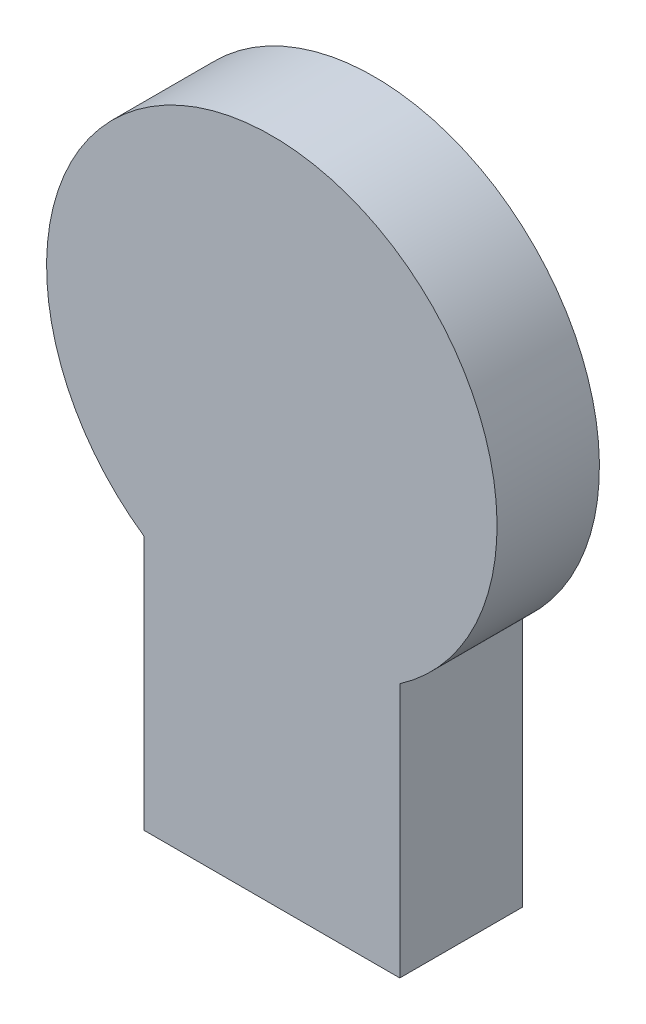
from build123d import *

# Parameters (mm, degrees)
BOSS_EXTRUDE1_DEPTH = 20
CUT_EXTRUDE1_DEPTH  = 15
BOSS_EXTRUDE2_DEPTH = 4


with BuildPart() as part:
    # Sketch2 → Boss-Extrude1 (new body)
    with BuildSketch(Plane.XY):
        with BuildLine():
            ThreePointArc((44, 0), (-20.4450483, 38.961519478), (-25, -36.20773398))
            ThreePointArc((-25, -36.20773398), (0, -44), (25, -36.20773398))
            ThreePointArc((25, -36.20773398), (38.961519478, -20.4450483), (44, 0))
        make_face()
        with BuildLine():
            ThreePointArc((-25, -36.20773398), (0, -44), (25, -36.20773398))
            Line((25, -36.20773398), (25, -86))
            Line((25, -86), (-25, -86))
            Line((-25, -86), (-25, -36.20773398))
        make_face()
    extrude(amount=BOSS_EXTRUDE1_DEPTH)

    # Sketch3 → Cut-Extrude1 (cut)
    with BuildSketch(Plane(origin=(0, 0, 0), x_dir=(-1, 0, 0), z_dir=(0, 0, -1))):
        with BuildLine():
            Line((-20, -33.481338086), (-20, -81))
            Line((-20, -81), (20, -81))
            Line((20, -81), (20, -33.481338086))
            ThreePointArc((20, -33.481338086), (0, 39), (-20, -33.481338086))
        make_face()
    extrude(amount=-CUT_EXTRUDE1_DEPTH, mode=Mode.SUBTRACT)

    # Sketch4 → Boss-Extrude2 (add)
    with BuildSketch(Plane(origin=(0, 0, 0), x_dir=(-1, 0, 0), z_dir=(0, 0, -1))):
        Polygon((-20, -36.20773398), (-25, -36.20773398), (-25, -86), (25, -86), (25, -36.20773398), (20, -36.20773398), (20, -81), (-20, -81), align=None)
    extrude(amount=BOSS_EXTRUDE2_DEPTH)


solid = part.part
